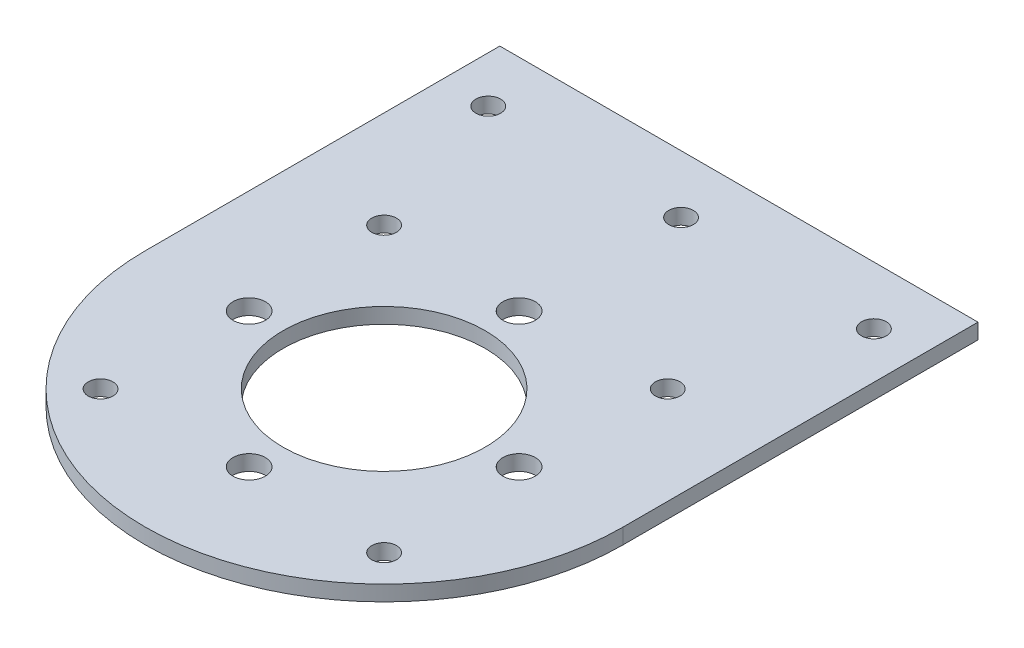
from build123d import *

# Parameters (mm, degrees)
SKETCH_1_R      = 1.6
SKETCH_1_R_2    = 31
SKETCH_1_R_3    = 21
SKETCH_1_R_4    = 2.1
SKETCH_1_R_5    = 13.1
EXTRUDE_1_DEPTH = 2


with BuildPart() as part:
    # 草图1 → 凸台-拉伸1 (new body)
    # profile 1 of 3: a face of its own
    with BuildSketch(Plane(origin=(0, 0, 0), x_dir=(1, 0, 0), z_dir=(0, 1, 0))):
        with BuildLine():
            Line((-31, 31), (-31, 0))
            ThreePointArc((-31, 0), (0, 31), (31, 0))
            Line((31, 0), (31, 31))
            Line((31, 31), (31, 46))
            Line((31, 46), (-31, 46))
            Line((-31, 46), (-31, 31))
        make_face()
        with Locations(Location((-25, 38.5, 0), (0, 0, 270))):
            Circle(SKETCH_1_R, mode=Mode.SUBTRACT)
        with Locations(Location((0, 38.5, 0), (0, 0, 270))):
            Circle(SKETCH_1_R, mode=Mode.SUBTRACT)
        with Locations(Location((25, 38.5, 0), (0, 0, 270))):
            Circle(SKETCH_1_R, mode=Mode.SUBTRACT)
    # profile 2 of 3: a face of its own
    with BuildSketch(Plane(origin=(0, 0, 0), x_dir=(1, 0, 0), z_dir=(0, 1, 0))):
        Circle(SKETCH_1_R_2)
        with Locations(Location((-18.384776311, 18.384776311, 0), (0, 0, 270))):
            Circle(SKETCH_1_R, mode=Mode.SUBTRACT)
        with Locations(Location((-18.384776311, -18.384776311, 0), (0, 0, 270))):
            Circle(SKETCH_1_R, mode=Mode.SUBTRACT)
        with Locations(Location((18.384776311, -18.384776311, 0), (0, 0, 270))):
            Circle(SKETCH_1_R, mode=Mode.SUBTRACT)
        with Locations(Location((18.384776311, 18.384776311, 0), (0, 0, 270))):
            Circle(SKETCH_1_R, mode=Mode.SUBTRACT)
        Circle(SKETCH_1_R_3, mode=Mode.SUBTRACT)
    # profile 3 of 3: a face of its own
    with BuildSketch(Plane(origin=(0, 0, 0), x_dir=(1, 0, 0), z_dir=(0, 1, 0))):
        Circle(SKETCH_1_R_3)
        with Locations(Location((17.5, 0, 0), (0, 0, 270))):
            Circle(SKETCH_1_R_4, mode=Mode.SUBTRACT)
        with Locations(Location((0, -17.5, 0), (0, 0, 270))):
            Circle(SKETCH_1_R_4, mode=Mode.SUBTRACT)
        with Locations(Location((-17.5, 0, 0), (0, 0, 270))):
            Circle(SKETCH_1_R_4, mode=Mode.SUBTRACT)
        with Locations(Location((0, 17.5, 0), (0, 0, 270))):
            Circle(SKETCH_1_R_4, mode=Mode.SUBTRACT)
        with Locations(Location((0, 0, 0), (0, 0, 270))):
            Circle(SKETCH_1_R_5, mode=Mode.SUBTRACT)
    extrude(amount=EXTRUDE_1_DEPTH)


solid = part.part
